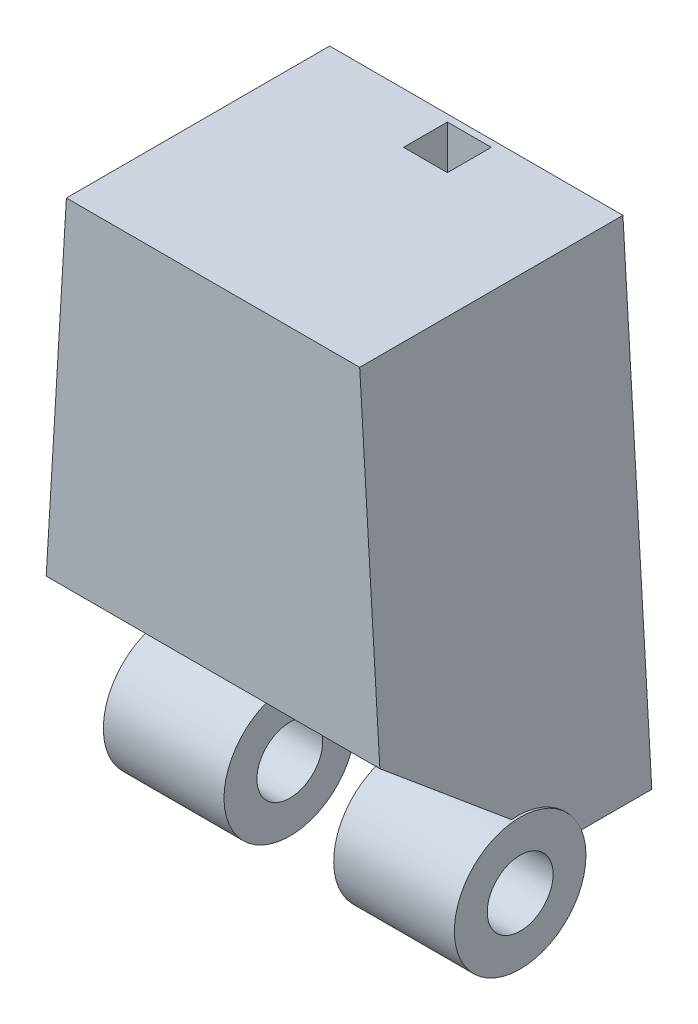
from build123d import *

# Parameters (mm, degrees)
BOSS_EXTRUDE1_DEPTH     = 12
CUT_EXTRUDE1_DEPTH      = 33.105995151
CUT_EXTRUDE1_DEPTH_BACK = 33.105995151
SKETCH6_R               = 3
SKETCH6_R_2             = 1.5
BOSS_EXTRUDE2_DEPTH     = 8
SKETCH6_3_R             = 3
SKETCH6_3_R_2           = 1.5
CUT_EXTRUDE2_DEPTH      = 2.5
CUT_EXTRUDE3_DEPTH      = 5
SKETCH8_R               = 1.5
BOSS_EXTRUDE3_DEPTH     = 5.5
CUT_EXTRUDE4_DEPTH      = 33.105995151
CUT_EXTRUDE4_DEPTH_BACK = 33.105995151
SKETCH9_W               = 12
SKETCH9_H               = 6.684402114
SKETCH10_W              = 2
SKETCH10_H              = 23.335099084
CUT_EXTRUDE5_DEPTH      = 1


with BuildPart() as part:
    # Sketch1 → Boss-Extrude1 (new body)
    with BuildSketch(Plane.XY):
        with BuildLine():
            Line((-56.5742778, 0), (-40.5742778, 0))
            Line((-40.5742778, 0), (-41.889875686, 22))
            ThreePointArc((-41.889875686, 22), (-48.5742778, 28.684402114), (-55.258679913, 22))
            Line((-55.258679913, 22), (-56.5742778, 0))
        make_face()
    extrude(amount=BOSS_EXTRUDE1_DEPTH)

    # Sketch3 → Cut-Extrude1 (cut, two sides: drawn at the far end of the back side and taken through both)
    with BuildSketch(Plane(origin=(-48.5742778, 0, 0), x_dir=(0, 0, -1), z_dir=(1, 0, 0)).offset(-CUT_EXTRUDE1_DEPTH_BACK)):
        Polygon((-12, 0), (-4, 0), (-12, 6.613954944), align=None)
    extrude(amount=CUT_EXTRUDE1_DEPTH + CUT_EXTRUDE1_DEPTH_BACK, mode=Mode.SUBTRACT)

    # Sketch6 → Boss-Extrude2 (add, symmetric)
    with BuildSketch(Plane(origin=(-48.5742778, 0, 0), x_dir=(0, 0, -1), z_dir=(1, 0, 0))):
        with Locations((-6, -1.1)):
            Circle(SKETCH6_R)
        with Locations((-6, -1.1)):
            Circle(SKETCH6_R_2, mode=Mode.SUBTRACT)
    extrude(amount=BOSS_EXTRUDE2_DEPTH, both=True)

    # Sketch6<3> → Cut-Extrude2 (cut, symmetric)
    with BuildSketch(Plane(origin=(-48.5742778, 0, 0), x_dir=(0, 0, -1), z_dir=(1, 0, 0))):
        with Locations((-6, -1.1)):
            Circle(SKETCH6_3_R)
        with Locations((-6, -1.1)):
            Circle(SKETCH6_3_R_2, mode=Mode.SUBTRACT)
    extrude(amount=CUT_EXTRUDE2_DEPTH, both=True, mode=Mode.SUBTRACT)

    # Sketch7 → Cut-Extrude3 (cut, symmetric)
    with BuildSketch(Plane(origin=(-48.5742778, 0, 0), x_dir=(0, 0, -1), z_dir=(1, 0, 0))):
        Polygon((-7.161655697, 2.613881041), (-11.015220244, 5.799793827), (-7.829307458, 9.653358374), (-3.975742911, 6.467445588), align=None)
    extrude(amount=CUT_EXTRUDE3_DEPTH, both=True, mode=Mode.SUBTRACT)

    # Sketch8 → Boss-Extrude3 (add, symmetric)
    with BuildSketch(Plane(origin=(-48.5742778, 0, 0), x_dir=(0, 0, -1), z_dir=(1, 0, 0))):
        with Locations((-7.548090256, 6.177113636)):
            Circle(SKETCH8_R)
    extrude(amount=BOSS_EXTRUDE3_DEPTH, both=True)

    # Sketch9 → Cut-Extrude4 (cut, two sides: drawn at the far end of the back side and taken through both)
    with BuildSketch(Plane(origin=(-48.5742778, 0, 0), x_dir=(0, 0, -1), z_dir=(1, 0, 0)).offset(-CUT_EXTRUDE4_DEPTH_BACK)):
        with Locations((-6, 25.342201057)):
            Rectangle(SKETCH9_W, SKETCH9_H)
    extrude(amount=CUT_EXTRUDE4_DEPTH + CUT_EXTRUDE4_DEPTH_BACK, mode=Mode.SUBTRACT)

    # Sketch10 → Cut-Extrude5 (cut, symmetric)
    with BuildSketch(Plane(origin=(-48.5742778, 0, 0), x_dir=(0, 0, -1), z_dir=(1, 0, 0))):
        with Locations((-1.316111108, 11.667549542)):
            Rectangle(SKETCH10_W, SKETCH10_H)
    extrude(amount=CUT_EXTRUDE5_DEPTH, both=True, mode=Mode.SUBTRACT)


solid = part.part
